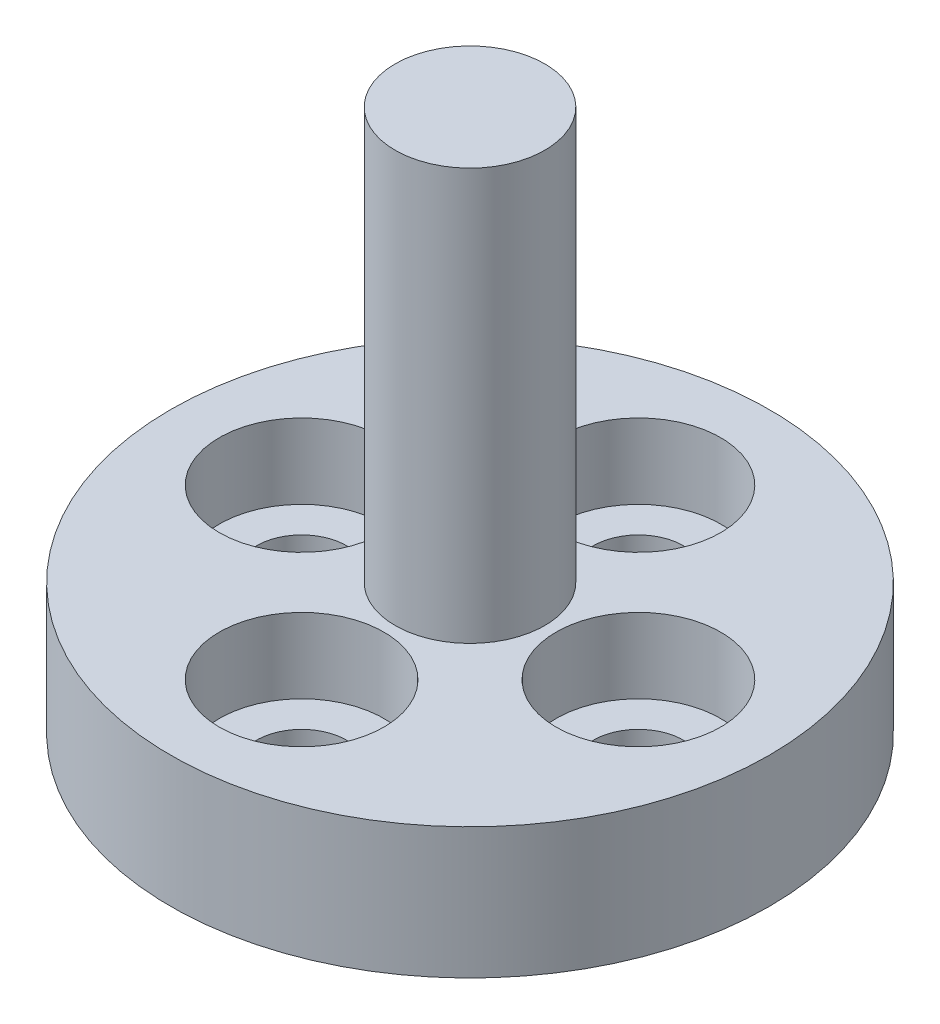
from build123d import *

# Parameters (mm, degrees)
HOLE_WIZARD_M2_1_D           = 2.4
HOLE_WIZARD_M2_1_CBORE_D     = 4.4
HOLE_WIZARD_M2_1_CBORE_DEPTH = 2


with BuildPart() as part:
    # 草图1 → 旋转1 (revolve)
    with BuildSketch(Plane.XY, mode=Mode.PRIVATE) as revolve_1_sk:
        Polygon((0, 0), (8, 0), (8, 3.5), (2, 3.5), (2, 14.5), (0, 14.5), align=None)
    revolve(revolve_1_sk.sketch.rotate(Axis((0, 14.5, 0), (0, -1, 0)), 180), axis=Axis((0, 14.5, 0), (0, -1, 0)))

    # M2 凹头盖螺钉的柱形沉头孔1 (through all)
    with Locations(Plane(origin=(0, 3.5, 0), x_dir=(1, 0, 0), z_dir=(0, 1, 0))):
        with Locations((-4.5, 0), (0, 4.5), (4.5, 0), (0, -4.5)):
            CounterBoreHole(HOLE_WIZARD_M2_1_D / 2, HOLE_WIZARD_M2_1_CBORE_D / 2, HOLE_WIZARD_M2_1_CBORE_DEPTH)


solid = part.part
